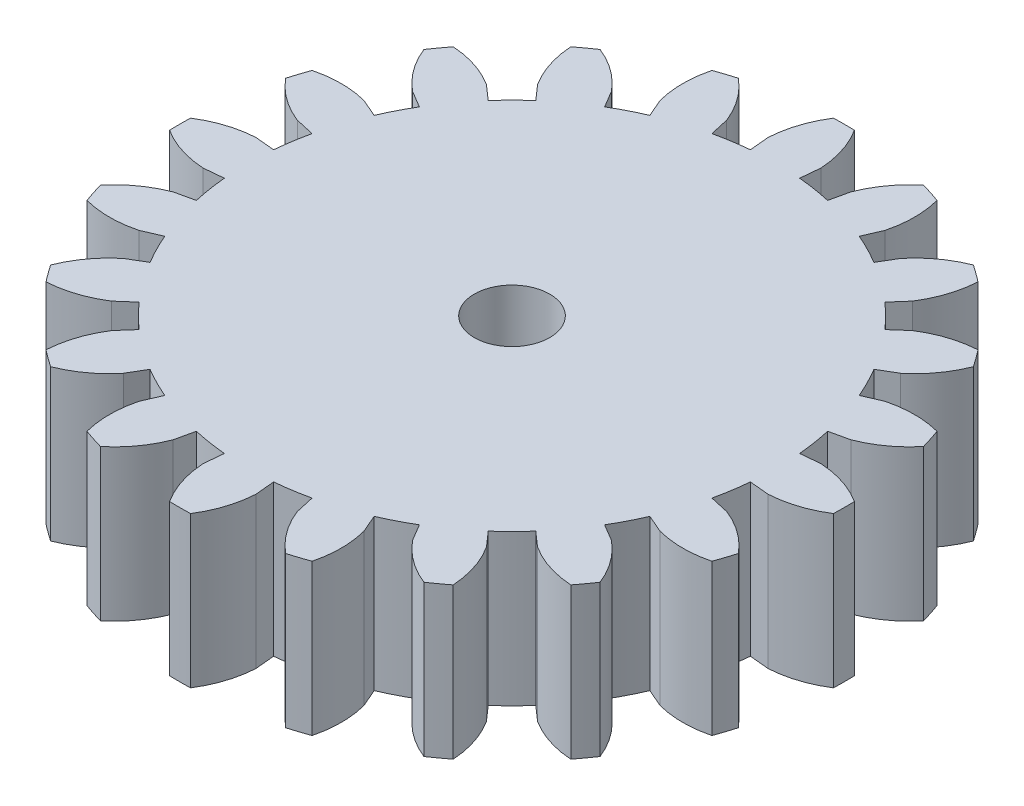
from build123d import *

# Parameters (mm, degrees)
SKETCH_1_R               = 17.5
EXTRUDE_1_DEPTH          = 10
EXTRUDE_2_DEPTH          = 10
PATTERN_CIRCULAR_1_COUNT = 20
SKETCH_3_R               = 2.5
CUT_EXTRUDE_1_DEPTH      = 33.680269277


with BuildPart() as part:
    # Эскиз1 → Бобышка-Вытянуть1 (new body)
    with BuildSketch(Plane(origin=(0, 0, 0), x_dir=(1, 0, 0), z_dir=(0, 1, 0))):
        with Locations(Location((0, 0, 0), (0, 0, 270))):
            Circle(SKETCH_1_R)
    extrude(amount=EXTRUDE_1_DEPTH)

    # Эскиз2 → Бобышка-Вытянуть2 (add)
    with BuildSketch(Plane.XZ):
        with BuildLine():
            Line((-1.631691003, 17.423764934), (-1.752328912, 18.711978549))
            ThreePointArc((-1.752328912, 18.711978549), (-1.433460227, 20.418219236), (-0.694874519, 21.989023384))
            ThreePointArc((-0.694874519, 21.989023384), (0, 22), (0.694874519, 21.989023384))
            ThreePointArc((0.694874519, 21.989023384), (1.433460227, 20.418219236), (1.752328912, 18.711978549))
            Line((1.752328912, 18.711978549), (1.631691003, 17.423764934))
            ThreePointArc((1.631691003, 17.423764934), (0, 17.5), (-1.631691003, 17.423764934))
        make_face()
    extrude_2 = extrude(amount=-EXTRUDE_2_DEPTH)

    # Круговой массив1: Бобышка-Вытянуть2 ×20 about axis
    pattern_circular_1_axis = Axis((0, 0, 0), (0, 1, 0))
    for i in range(1, PATTERN_CIRCULAR_1_COUNT):
        add(extrude_2.rotate(pattern_circular_1_axis, i * 360 / PATTERN_CIRCULAR_1_COUNT))

    # Эскиз3 → Вырез-Вытянуть1 (cut, through all)
    with BuildSketch(Plane.XZ):
        with Locations(Location((0, 0, 0), (0, 0, 270))):
            Circle(SKETCH_3_R)
    extrude(amount=-CUT_EXTRUDE_1_DEPTH, mode=Mode.SUBTRACT)


solid = part.part
